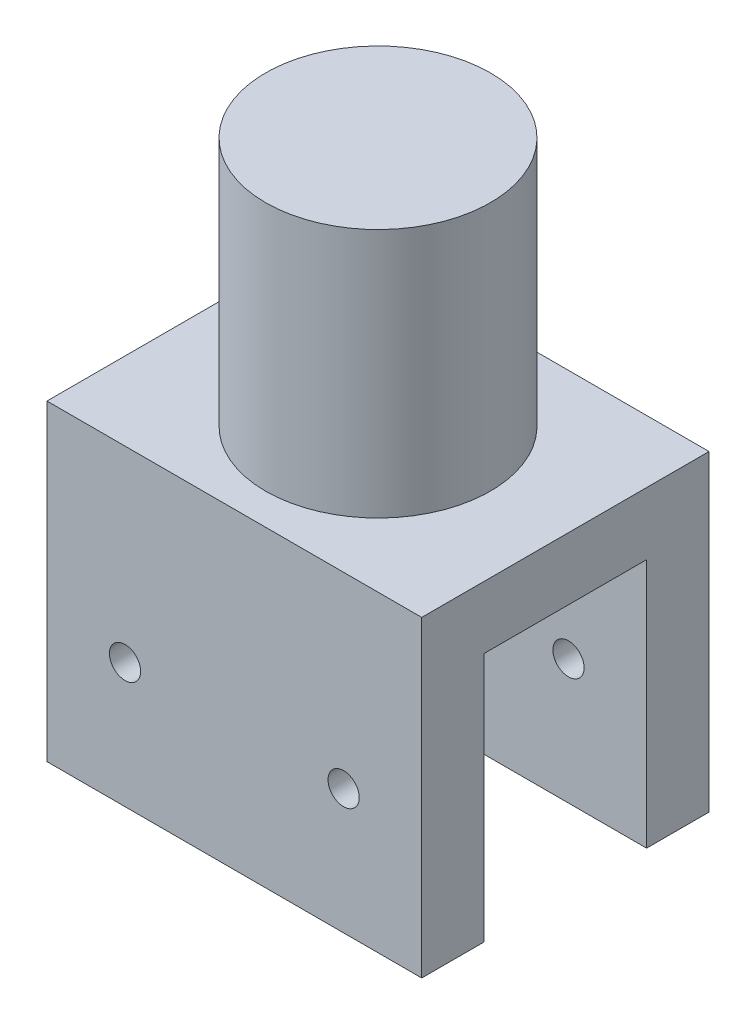
from build123d import *

# Parameters (mm, degrees)
SKETCH1_W           = 60
SKETCH1_H           = 46
BOSS_EXTRUDE1_DEPTH = 10
SKETCH2_W           = 60
SKETCH2_H           = 10
BOSS_EXTRUDE2_DEPTH = 40
SKETCH3_R           = 18
BOSS_EXTRUDE3_DEPTH = 40
SKETCH4_R           = 2.5
CUT_EXTRUDE1_DEPTH  = 75.269778511


with BuildPart() as part:
    # Sketch1 → Boss-Extrude1 (new body)
    with BuildSketch(Plane(origin=(0, 0, 0), x_dir=(1, 0, 0), z_dir=(0, 1, 0))):
        Rectangle(SKETCH1_W, SKETCH1_H)
    extrude(amount=BOSS_EXTRUDE1_DEPTH)

    # Sketch2 → Boss-Extrude2 (add)
    with BuildSketch(Plane.XZ):
        with Locations((0, 18)):
            Rectangle(SKETCH2_W, SKETCH2_H)
        with Locations((0, -18)):
            Rectangle(SKETCH2_W, SKETCH2_H)
    extrude(amount=BOSS_EXTRUDE2_DEPTH)

    # Sketch3 → Boss-Extrude3 (add)
    with BuildSketch(Plane(origin=(0, 10, 0), x_dir=(1, 0, 0), z_dir=(0, 1, 0))):
        with Locations(Location((0, 0, 0), (0, 0, 270))):
            Circle(SKETCH3_R)
    extrude(amount=BOSS_EXTRUDE3_DEPTH)

    # Sketch4 → Cut-Extrude1 (cut, through all)
    with BuildSketch(Plane(origin=(0, 0, -23), x_dir=(-1, 0, 0), z_dir=(0, 0, -1))):
        with Locations((-17.5, -20)):
            Circle(SKETCH4_R)
        with Locations((17.5, -20)):
            Circle(SKETCH4_R)
    extrude(amount=-CUT_EXTRUDE1_DEPTH, mode=Mode.SUBTRACT)


solid = part.part
